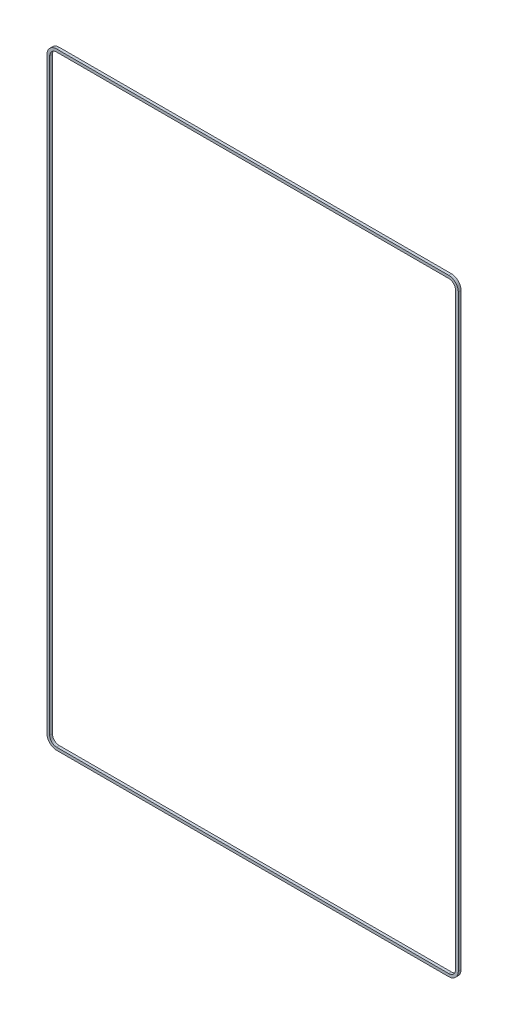
from build123d import *

# Parameters (mm, degrees)
BOSS_EXTRUDE1_DEPTH = 1.778


with BuildPart() as part:
    # Sketch1 → Boss-Extrude1 (new body)
    with BuildSketch(Plane.XY):
        with BuildLine():
            ThreePointArc((4.318, -1.905), (-0.082325499, -0.082325499), (-1.905, 4.318))
            Line((-1.905, 4.318), (-1.905, 385.318))
            ThreePointArc((-1.905, 385.318), (-0.082325499, 389.718325499), (4.318, 391.541))
            Line((4.318, 391.541), (258.318, 391.541))
            ThreePointArc((258.318, 391.541), (262.718325499, 389.718325499), (264.541, 385.318))
            Line((264.541, 385.318), (264.541, 4.318))
            ThreePointArc((264.541, 4.318), (262.718325499, -0.082325499), (258.318, -1.905))
            Line((258.318, -1.905), (4.318, -1.905))
        make_face()
        with BuildLine():
            Line((4.318, -0.127), (258.318, -0.127))
            ThreePointArc((258.318, -0.127), (261.461089642, 1.174910358), (262.763, 4.318))
            Line((262.763, 4.318), (262.763, 385.318))
            ThreePointArc((262.763, 385.318), (261.461089642, 388.461089642), (258.318, 389.763))
            Line((258.318, 389.763), (4.318, 389.763))
            ThreePointArc((4.318, 389.763), (1.174910358, 388.461089642), (-0.127, 385.318))
            Line((-0.127, 385.318), (-0.127, 4.318))
            ThreePointArc((-0.127, 4.318), (1.174910358, 1.174910358), (4.318, -0.127))
        make_face(mode=Mode.SUBTRACT)
    extrude(amount=BOSS_EXTRUDE1_DEPTH)


solid = part.part
